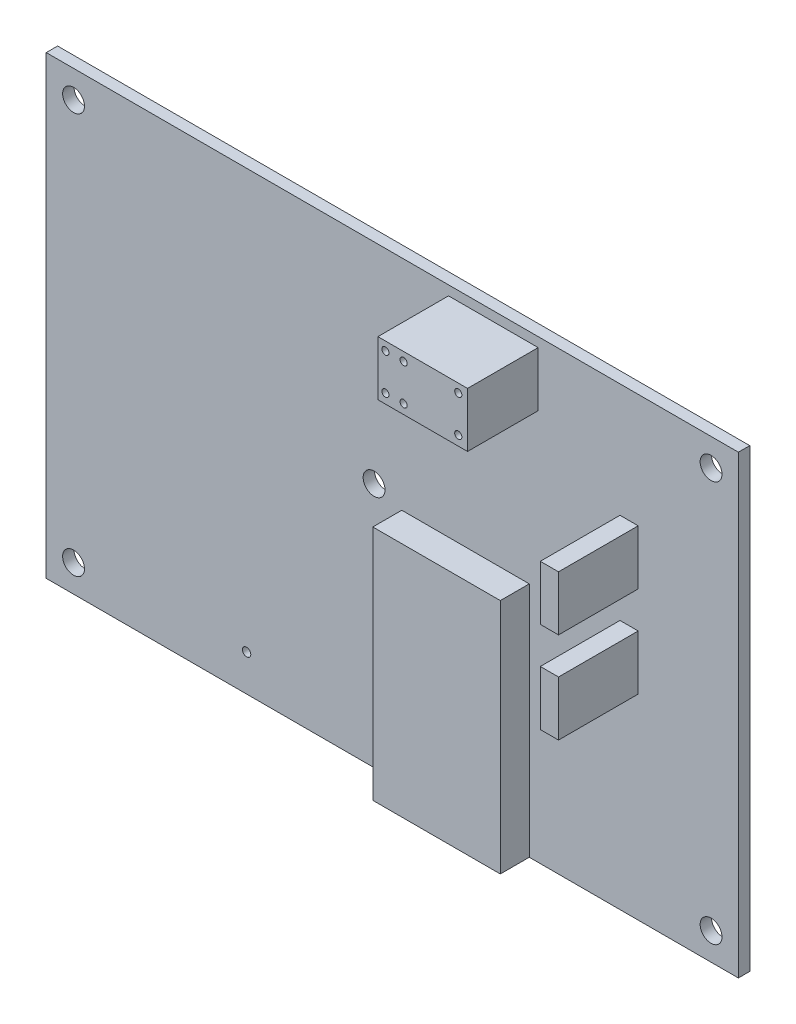
from build123d import *

# Parameters (mm, degrees)
SKETCH1_W            = 96.52
SKETCH1_H            = 63.5
BOSS_EXTRUDE1_DEPTH  = 1.5875
SKETCH2_R            = 0.5842
SKETCH2_R_2          = 1.524
SKETCH2_R_3          = 0.508
HOLES_DEPTH          = 116.54601056
SKETCH3_W            = 17.78
SKETCH3_H            = 33.02
PRO_MICRO_DEPTH      = 4.0386
SKETCH4_R            = 1.524
MOUNTING_HOLES_DEPTH = 116.605668935
SKETCH5_W            = 12.5
SKETCH5_H            = 7.62
SKETCH5_R            = 0.5
DC_RELAY_DEPTH       = 9.85
SKETCH6_W            = 2.54
SKETCH6_H            = 7.62
BOSS_EXTRUDE2_DEPTH  = 11.1125


with BuildPart() as part:
    # Sketch1 → Boss-Extrude1 (new body)
    with BuildSketch(Plane.XY):
        with Locations((-48.26, 31.75)):
            Rectangle(SKETCH1_W, SKETCH1_H)
    extrude(amount=BOSS_EXTRUDE1_DEPTH)

    # Sketch2 → Holes (cut, through all)
    with BuildSketch(Plane.XY.offset(1.5875)):
        with Locations((-68.58, 5.08)):
            Circle(SKETCH2_R)
        with Locations((-50.8, 34.29)):
            Circle(SKETCH2_R_2)
        with Locations((-15.24, 46.355)):
            Circle(SKETCH2_R_3)
        with Locations((-15.24, 43.815)):
            Circle(SKETCH2_R_3)
        with Locations((-15.24, 41.275)):
            Circle(SKETCH2_R_3)
        with Locations((-15.24, 33.655)):
            Circle(SKETCH2_R_3)
        with Locations((-15.24, 31.115)):
            Circle(SKETCH2_R_3)
        with Locations((-15.24, 28.575)):
            Circle(SKETCH2_R_3)
    extrude(amount=-HOLES_DEPTH, mode=Mode.SUBTRACT)

    # Sketch3 → pro micro (add)
    with BuildSketch(Plane.XY.offset(1.5875)):
        with Locations((-38.0492, 16.51)):
            Rectangle(SKETCH3_W, SKETCH3_H)
    extrude(amount=PRO_MICRO_DEPTH)

    # Sketch4 → mounting holes (cut, through all)
    with BuildSketch(Plane.XY.offset(1.5875)):
        with Locations((-92.71, 3.81)):
            Circle(SKETCH4_R)
        with Locations((-92.71, 59.69)):
            Circle(SKETCH4_R)
        with Locations((-3.81, 59.69)):
            Circle(SKETCH4_R)
        with Locations((-3.81, 3.81)):
            Circle(SKETCH4_R)
    extrude(amount=-MOUNTING_HOLES_DEPTH, mode=Mode.SUBTRACT)

    # Sketch5 → DC relay (add)
    with BuildSketch(Plane.XY.offset(1.5875)):
        with Locations((-34.17, 58.36)):
            Rectangle(SKETCH5_W, SKETCH5_H)
        with Locations((-39.37, 60.96)):
            Circle(SKETCH5_R, mode=Mode.SUBTRACT)
        with Locations((-39.37, 55.88)):
            Circle(SKETCH5_R, mode=Mode.SUBTRACT)
        with Locations((-36.83, 60.96)):
            Circle(SKETCH5_R, mode=Mode.SUBTRACT)
        with Locations((-29.21, 60.96)):
            Circle(SKETCH5_R, mode=Mode.SUBTRACT)
        with Locations((-36.83, 55.88)):
            Circle(SKETCH5_R, mode=Mode.SUBTRACT)
        with Locations((-29.21, 55.88)):
            Circle(SKETCH5_R, mode=Mode.SUBTRACT)
    extrude(amount=DC_RELAY_DEPTH)

    # Sketch6 → Boss-Extrude2 (add)
    with BuildSketch(Plane.XY.offset(1.5875)):
        with Locations((-15.24, 43.815)):
            Rectangle(SKETCH6_W, SKETCH6_H)
        with Locations((-15.24, 31.115)):
            Rectangle(SKETCH6_W, SKETCH6_H)
    extrude(amount=BOSS_EXTRUDE2_DEPTH)


solid = part.part
